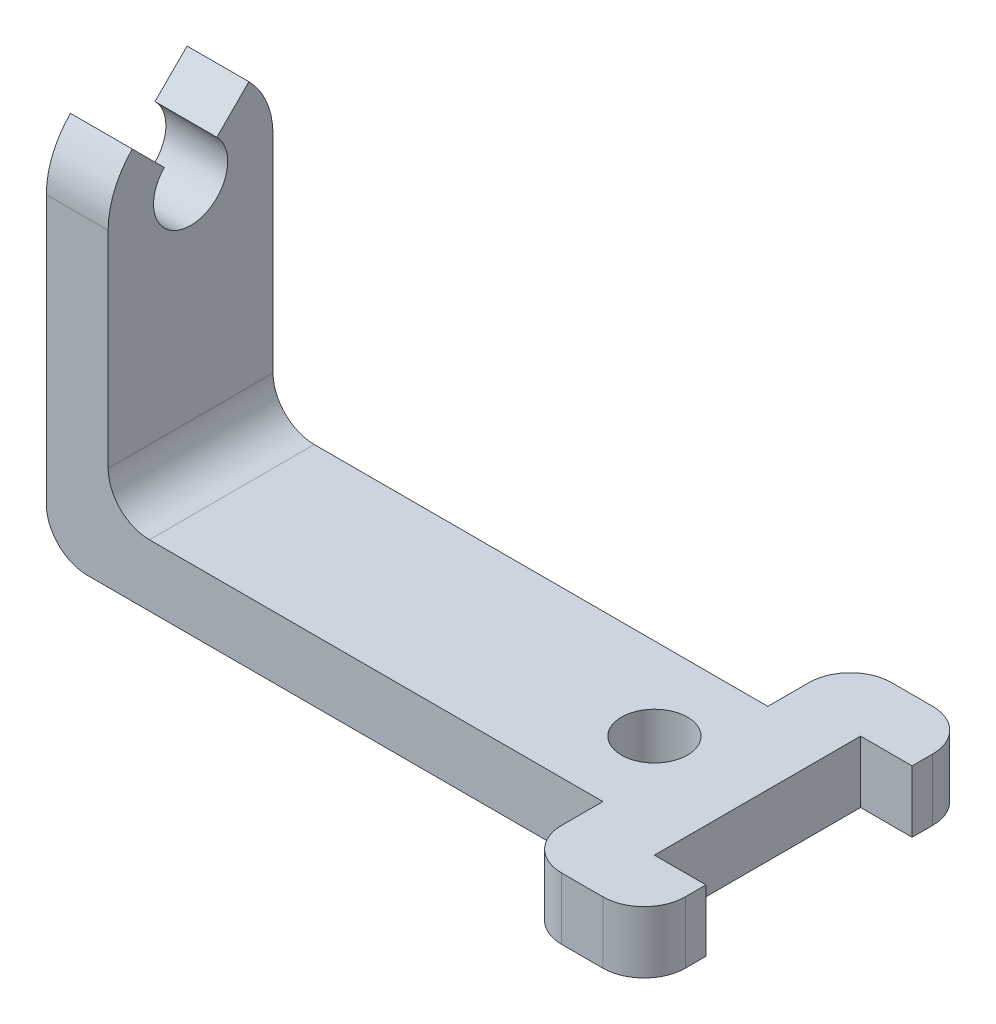
from build123d import *

# Parameters (mm, degrees)
SKETCH_1_R      = 1.6
EXTRUDE_1_DEPTH = 3
EXTRUDE_2_DEPTH = 3
FILLET_1_R      = 2
FILLET_2_R      = 2


with BuildPart() as part:
    # 草图1 → 凸台-拉伸1 (new body)
    with BuildSketch(Plane(origin=(0, 0, 0), x_dir=(1, 0, 0), z_dir=(0, 1, 0))):
        Polygon((-14.5, -4), (-14.5, 4), (12.5, 4), (12.5, 8), (18.5, 8), (18.5, 5), (16, 5), (16, -5), (18.5, -5), (18.5, -8), (12.5, -8), (12.5, -4), align=None)
        with Locations(Location((11, 0, 0), (0, 0, 270))):
            Circle(SKETCH_1_R, mode=Mode.SUBTRACT)
    extrude(amount=EXTRUDE_1_DEPTH)

    # 草图3 → 凸台-拉伸2 (add)
    with BuildSketch(Plane.ZY.offset(14.5)):
        with BuildLine():
            Line((-4, 15), (-4, 3))
            Line((-4, 3), (4, 3))
            Line((4, 3), (4, 15))
            ThreePointArc((4, 15), (3.69551813, 16.530733729), (2.828427125, 17.828427125))
            Line((2.828427125, 17.828427125), (1.272792206, 16.272792206))
            ThreePointArc((1.272792206, 16.272792206), (0, 13.2), (-1.272792206, 16.272792206))
            Line((-1.272792206, 16.272792206), (-2.828427125, 17.828427125))
            ThreePointArc((-2.828427125, 17.828427125), (-3.69551813, 16.530733729), (-4, 15))
        make_face()
    extrude(amount=-EXTRUDE_2_DEPTH)

    # 圆角1
    fillet_1_edges = [part.edges().sort_by_distance(p)[0] for p in [
        (12.5, 1.5, -8),
        (18.5, 1.5, -8),
        (18.5, 1.5, 8),
        (12.5, 1.5, 8),
    ]]
    fillet(fillet_1_edges, radius=FILLET_1_R)

    # 圆角2
    fillet_2_edges = [part.edges().sort_by_distance(p)[0] for p in [
        (-14.5, 0, 0),
        (-11.5, 3, 0),
    ]]
    fillet(fillet_2_edges, radius=FILLET_2_R)


solid = part.part
